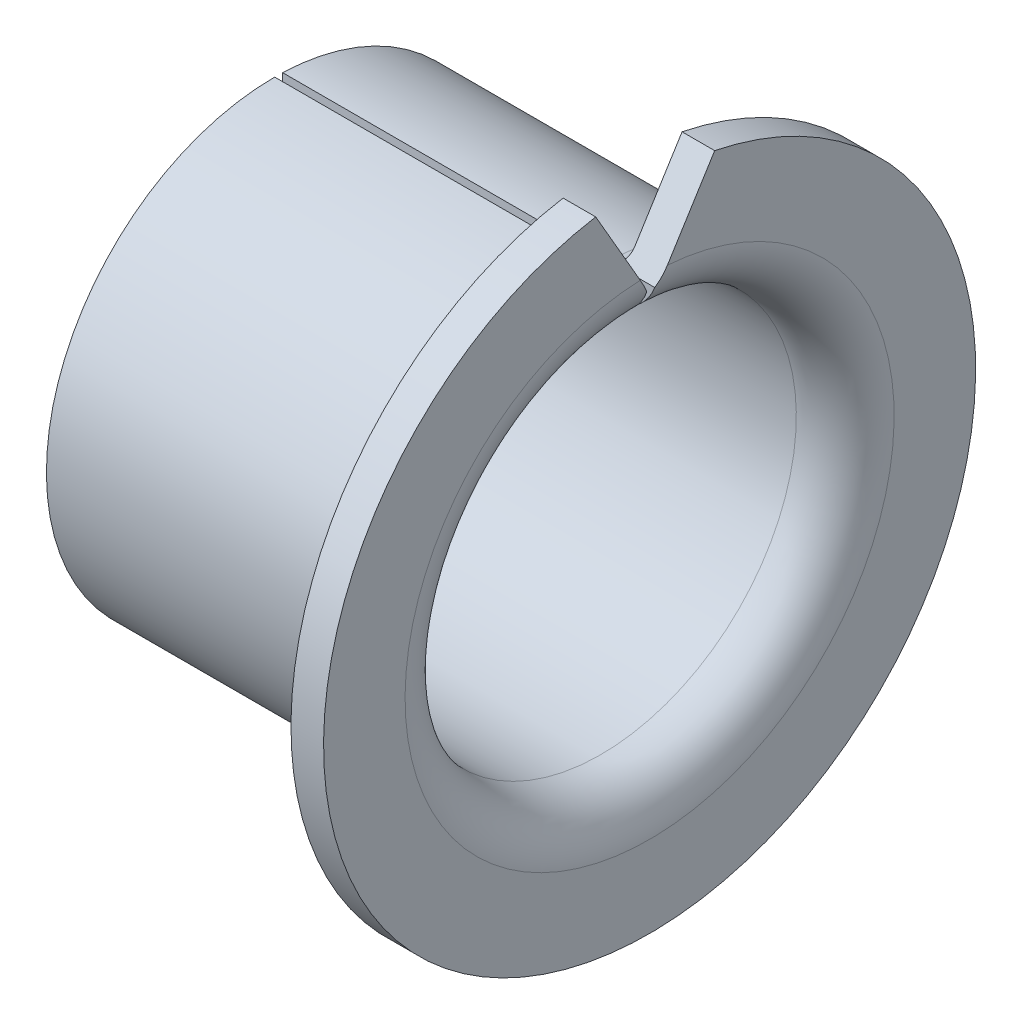
from build123d import *

# Parameters (mm, degrees)
BASE_R_VOLUTION_ANGLE   = 358
ENL_V_MAT_EXTRU_3_DEPTH = 19.227726134


with BuildPart() as part:
    # Esquisse1 → Base-Révolution (revolve)
    with BuildSketch(Plane.XY):
        with BuildLine():
            Line((0, 7), (10, 7))
            ThreePointArc((10, 7), (10.353553391, 7.146446609), (10.5, 7.5))
            Line((10.5, 7.5), (10.5, 10))
            Line((10.5, 10), (11.5, 10))
            Line((11.5, 10), (11.5, 7.5))
            ThreePointArc((11.5, 7.5), (11.060660172, 6.439339828), (10, 6))
            Line((10, 6), (0, 6))
            Line((0, 6), (0, 7))
        make_face()
    revolve(axis=Axis((0, 0, 0), (1, 0, 0)), revolution_arc=BASE_R_VOLUTION_ANGLE)

    # Esquisse2 → Enlèv. mat.-Extru.3 (cut, through all)
    with BuildSketch(Plane(origin=(0, 0, 0), x_dir=(0, 0, -1), z_dir=(1, 0, 0))):
        Polygon((0.244296477, 6.995735789), (2.079990656, 9.933460569), (0.348994967, 9.99390827), (0, 10), (-1.732050808, 10), (0, 7), align=None)
    extrude(amount=ENL_V_MAT_EXTRU_3_DEPTH, mode=Mode.SUBTRACT)


solid = part.part
